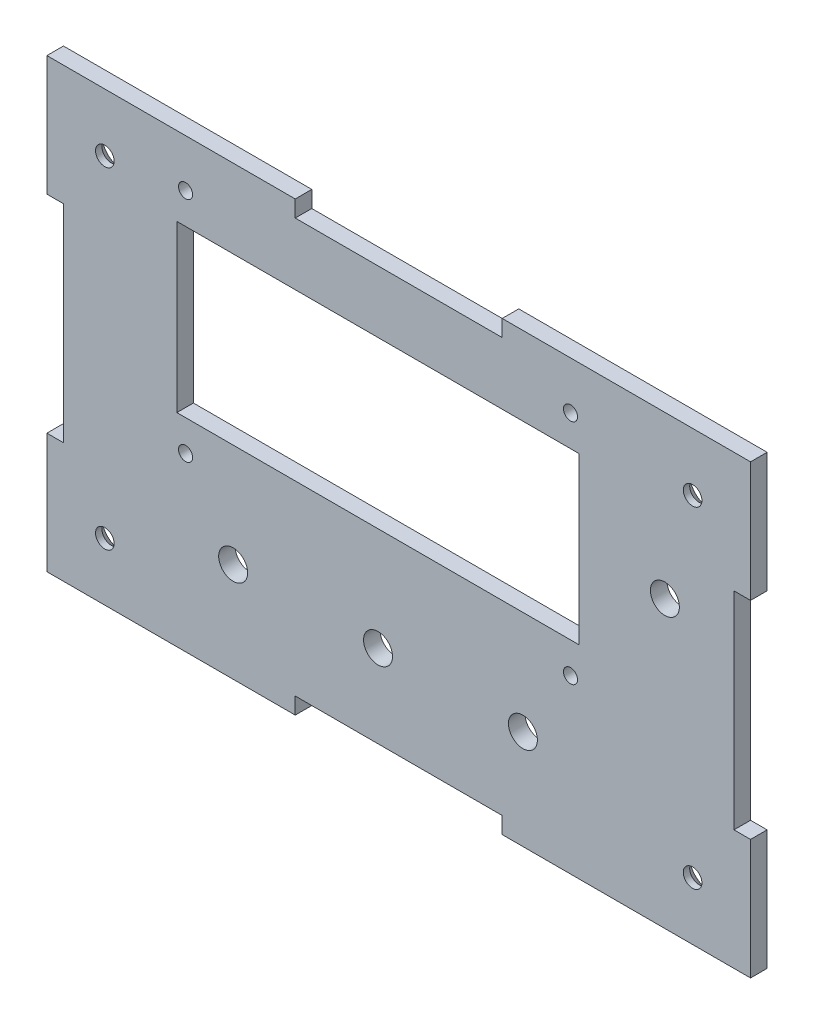
from build123d import *

# Parameters (mm, degrees)
SKETCH1_W                                    = 170
SKETCH1_H                                    = 108
PLATE_DEPTH                                  = 4
SKETCH2_W                                    = 97.2
SKETCH2_H                                    = 40
SCREEN_SLOT_DEPTH                            = 101.781942827
SCREEN_SCREW_HOLES_D                         = 3.4
SCREEN_SCREW_HOLES_CSINK_D                   = 6.3
SCREEN_SCREW_HOLES_CSINK_ANGLE               = 90
KNOB_HOLES_D                                 = 7
CUT_EXTRUDE2_REACH                           = 102.782
SKETCH8_W                                    = 50
SKETCH8_H                                    = 4
SKETCH8_W_2                                  = 4
SKETCH8_H_2                                  = 50
CSK_FOR_M4_COUNTERSUNK_FLAT_HEAD_SCR_2_COUNT = 2
CSK_FOR_M4_COUNTERSUNK_FLAT_HEAD_SCR_2_PITCH = 142
CSK_FOR_M4_COUNTERSUNK_FLAT_HEAD_SCR_3_COUNT = 2
CSK_FOR_M4_COUNTERSUNK_FLAT_HEAD_SCR_3_PITCH = 162.984661855
CSK_FOR_M4_COUNTERSUNK_FLAT_HEAD_SCR_4_COUNT = 2
CSK_FOR_M4_COUNTERSUNK_FLAT_HEAD_SCR_4_PITCH = 80


with BuildPart() as part:
    # Sketch1 → Plate (new body)
    with BuildSketch(Plane.XY):
        Rectangle(SKETCH1_W, SKETCH1_H)
    extrude(amount=PLATE_DEPTH)

    # Sketch2 → Screen slot (cut, through all)
    with BuildSketch(Plane(origin=(0, 0, 0), x_dir=(-1, 0, 0), z_dir=(0, 0, -1))):
        with Locations((5, 15)):
            Rectangle(SKETCH2_W, SKETCH2_H)
    extrude(amount=-SCREEN_SLOT_DEPTH, mode=Mode.SUBTRACT)

    # Screen screw holes (through all)
    with Locations(Plane(origin=(41.5, 42.5, 0), x_dir=(-1, 0, 0), z_dir=(0, 0, -1))):
        with Locations((0, 0), (93, 0), (93, -55), (0, -55)):
            CounterSinkHole(SCREEN_SCREW_HOLES_D / 2, SCREEN_SCREW_HOLES_CSINK_D / 2, counter_sink_angle=SCREEN_SCREW_HOLES_CSINK_ANGLE)

    # Knob holes (through all)
    with Locations(Plane(origin=(30, -30, 0), x_dir=(-1, 0, 0), z_dir=(0, 0, -1))):
        with Locations((0, 0), (35, 0), (70, 0), (-34.3, 45)):
            Hole(KNOB_HOLES_D / 2)

    # Sketch8 → Cut-Extrude2 (cut, up to next)
    with BuildSketch(Plane(origin=(0, 0, 0), x_dir=(-1, 0, 0), z_dir=(0, 0, -1)), mode=Mode.PRIVATE) as cut_extrude2_sk1:
        with Locations((0, 52)):
            Rectangle(SKETCH8_W, SKETCH8_H)
    cut_extrude2_tool1 = extrude(cut_extrude2_sk1.sketch, amount=-CUT_EXTRUDE2_REACH, mode=Mode.PRIVATE) & part.part
    # Sketch8 → Cut-Extrude2 (cut, up to next)
    with BuildSketch(Plane(origin=(0, 0, 0), x_dir=(-1, 0, 0), z_dir=(0, 0, -1)), mode=Mode.PRIVATE) as cut_extrude2_sk2:
        with Locations((83, 0)):
            Rectangle(SKETCH8_W_2, SKETCH8_H_2)
    cut_extrude2_tool2 = extrude(cut_extrude2_sk2.sketch, amount=-CUT_EXTRUDE2_REACH, mode=Mode.PRIVATE) & part.part
    # Sketch8 → Cut-Extrude2 (cut, up to next)
    with BuildSketch(Plane(origin=(0, 0, 0), x_dir=(-1, 0, 0), z_dir=(0, 0, -1)), mode=Mode.PRIVATE) as cut_extrude2_sk3:
        with Locations((0, -52)):
            Rectangle(SKETCH8_W, SKETCH8_H)
    cut_extrude2_tool3 = extrude(cut_extrude2_sk3.sketch, amount=-CUT_EXTRUDE2_REACH, mode=Mode.PRIVATE) & part.part
    # Sketch8 → Cut-Extrude2 (cut, up to next)
    with BuildSketch(Plane(origin=(0, 0, 0), x_dir=(-1, 0, 0), z_dir=(0, 0, -1)), mode=Mode.PRIVATE) as cut_extrude2_sk4:
        with Locations((-83, 0)):
            Rectangle(SKETCH8_W_2, SKETCH8_H_2)
    cut_extrude2_tool4 = extrude(cut_extrude2_sk4.sketch, amount=-CUT_EXTRUDE2_REACH, mode=Mode.PRIVATE) & part.part
    add(cut_extrude2_tool1.solids().sort_by_distance((0, 52, 0))[0], mode=Mode.SUBTRACT)
    add(cut_extrude2_tool2.solids().sort_by_distance((-83, 0, 0))[0], mode=Mode.SUBTRACT)
    add(cut_extrude2_tool3.solids().sort_by_distance((0, -52, 0))[0], mode=Mode.SUBTRACT)
    add(cut_extrude2_tool4.solids().sort_by_distance((83, 0, 0))[0], mode=Mode.SUBTRACT)

    # Sketch10 → CSK for M4 Countersunk Flat Head Screw1 (revolve, cut)
    with BuildSketch(Plane(origin=(71, 40, 0), x_dir=(0, 1, 0), z_dir=(1, 0, 0))):
        Polygon((0, 0), (0, 4), (2.25, 4), (2.25, 2.45), (4.7, 0), align=None)
    csk_for_m4_countersunk_flat_head_screw1 = revolve(axis=Axis((71, 40, -6.35), (0, 0, 1)), mode=Mode.SUBTRACT)

    # CSK for M4 Countersunk Flat Head Scr 2: CSK for M4 Countersunk Flat Head Screw1 ×2
    with Locations(*[(-i * CSK_FOR_M4_COUNTERSUNK_FLAT_HEAD_SCR_2_PITCH, 0, 0) for i in range(1, CSK_FOR_M4_COUNTERSUNK_FLAT_HEAD_SCR_2_COUNT)]):
        add(csk_for_m4_countersunk_flat_head_screw1, mode=Mode.SUBTRACT)

    # CSK for M4 Countersunk Flat Head Scr 3: CSK for M4 Countersunk Flat Head Screw1 ×2
    with Locations(*[Vector(-0.8712476277448776, -0.49084373394077596, 0) * (i * CSK_FOR_M4_COUNTERSUNK_FLAT_HEAD_SCR_3_PITCH) for i in range(1, CSK_FOR_M4_COUNTERSUNK_FLAT_HEAD_SCR_3_COUNT)]):
        add(csk_for_m4_countersunk_flat_head_screw1, mode=Mode.SUBTRACT)

    # CSK for M4 Countersunk Flat Head Scr 4: CSK for M4 Countersunk Flat Head Screw1 ×2
    with Locations(*[(0, -i * CSK_FOR_M4_COUNTERSUNK_FLAT_HEAD_SCR_4_PITCH, 0) for i in range(1, CSK_FOR_M4_COUNTERSUNK_FLAT_HEAD_SCR_4_COUNT)]):
        add(csk_for_m4_countersunk_flat_head_screw1, mode=Mode.SUBTRACT)


solid = part.part
